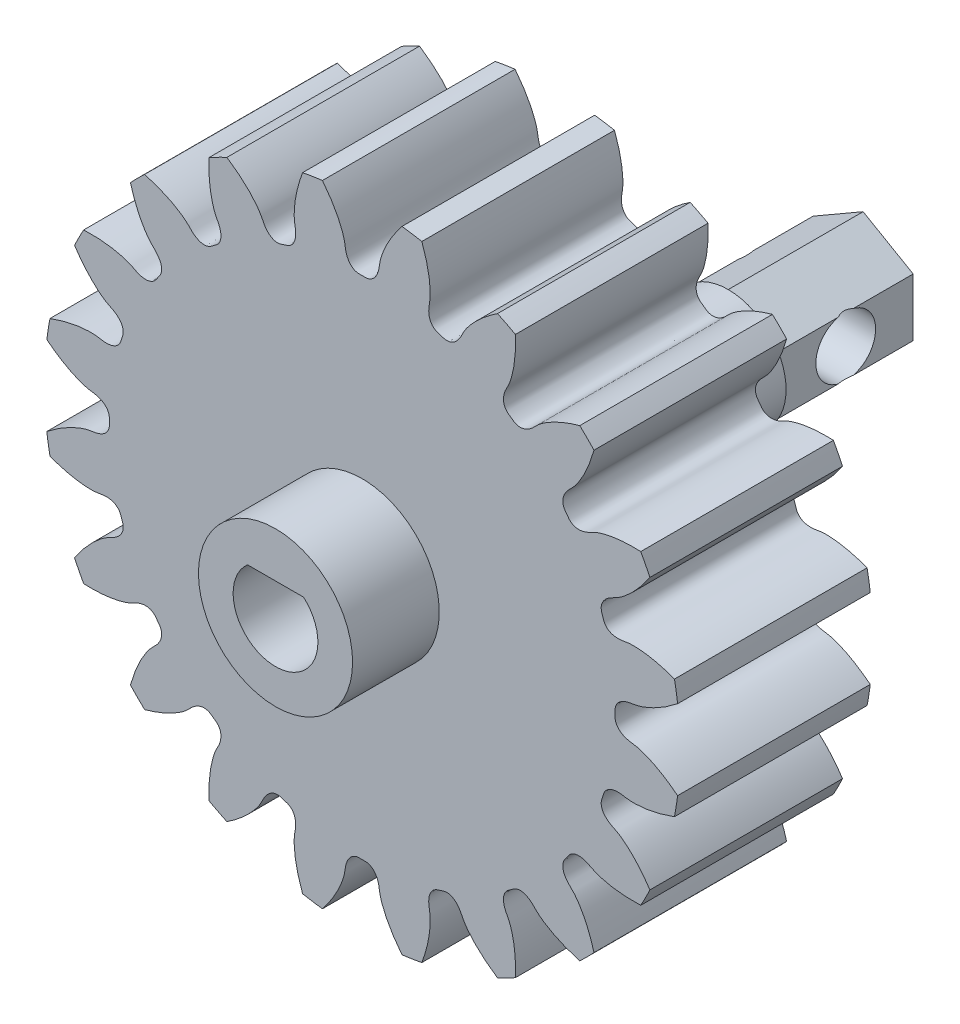
from build123d import *

# Parameters (mm, degrees)
SKETCHREVOLVESPURASSEMBLY01PINION_W       = 10
SKETCHREVOLVESPURASSEMBLY01PINION_H       = 16.499999752
TOOTHEXTRUDECUTSPURASSEMBLY01PINION_DEPTH = 5
PATTERNSPURASSEMBLY01PINION_COUNT         = 20
SKETCH2_R                                 = 3
BOSS_EXTRUDE1_DEPTH                       = 9
BOSS_EXTRUDE2_DEPTH                       = 7
CUT_EXTRUDE3_REACH                        = 34.692
SKETCH4_R                                 = 1.55
SKETCH5_R                                 = 4
BOSS_EXTRUDE3_DEPTH                       = 4.5
CUT_EXTRUDE4_DEPTH                        = 8


with BuildPart() as part:
    # SketchRevolveSpurAssembly01Pinion → SpurAssembly01Pinion (revolve)
    with BuildSketch(Plane(origin=(0, 0, 0), x_dir=(0, 0, -1), z_dir=(1, 0, 0)), mode=Mode.PRIVATE) as spurassembly01pinion_sk:
        with Locations((0, 8.249999876)):
            Rectangle(SKETCHREVOLVESPURASSEMBLY01PINION_W, SKETCHREVOLVESPURASSEMBLY01PINION_H)
    revolve(spurassembly01pinion_sk.sketch.rotate(Axis((0, 0, 0), (0, 0, -1)), 90), axis=Axis((0, 0, 0), (0, 0, -1)))

    # SketchToothSpurAssembly01Pinion → ToothExtrudeCutSpurAssembly01Pinion (cut, symmetric)
    with BuildSketch(Plane.XY):
        with BuildLine():
            ThreePointArc((16.438815928, 2.120364973), (16.574999751, 0), (16.438815928, -2.120364973))
            add(Edge.make_bspline(
                [(16.438815928, -2.120364973), (16.306213447, -2.012632117), (16.10792267, -1.860929635), (15.841705586, -1.676668952), (15.654853966, -1.55570694), (15.475899367, -1.447553762), (15.305444286, -1.351598726), (15.144060802, -1.267206194), (14.992289617, -1.193717223), (14.850639167, -1.130450865), (14.719584807, -1.0767054), (14.599567969, -1.031760257), (14.490995634, -0.99487577), (14.394239041, -0.965299916), (14.309634999, -0.942253529), (14.237479548, -0.924980687), (14.178044201, -0.912608864), (14.049223501, -0.890261122), (13.912281496, -0.878231728), (13.769652297, -0.842658369), (13.695599357, -0.820644128), (13.624377747, -0.794966749), (13.555692175, -0.765356143), (13.489258635, -0.731124882), (13.424830796, -0.691333031), (13.362331646, -0.644635632), (13.30209452, -0.589245233), (13.24524803, -0.523019137), (13.194309632, -0.443877425), (13.153279262, -0.350864326), (13.130262908, -0.253354669), (13.120821868, -0.134969136), (13.12767395, 0), (13.120821868, 0.134969136), (13.130262908, 0.253354669), (13.153279262, 0.350864326), (13.194309632, 0.443877425), (13.24524803, 0.523019137), (13.30209452, 0.589245233), (13.362331646, 0.644635632), (13.424830796, 0.691333031), (13.489258635, 0.731124882), (13.555692175, 0.765356143), (13.624377747, 0.794966749), (13.695599357, 0.820644128), (13.769652297, 0.842658369), (13.912281496, 0.878231728), (14.049223501, 0.890261122), (14.178044201, 0.912608864), (14.237479548, 0.924980687), (14.309634999, 0.942253529), (14.394239041, 0.965299916), (14.490995634, 0.99487577), (14.599567969, 1.031760257), (14.719584807, 1.0767054), (14.850639167, 1.130450865), (14.992289617, 1.193717223), (15.144060802, 1.267206194), (15.305444286, 1.351598726), (15.475899367, 1.447553762), (15.654853966, 1.55570694), (15.841705586, 1.676668952), (16.10792267, 1.860929635), (16.306213447, 2.012632117), (16.438815928, 2.120364973)],
                knots=[0, 0, 0, 0, 0.061422842, 0.089709677, 0.116380121, 0.141434175, 0.164871838, 0.186693111, 0.206897994, 0.225486485, 0.242458587, 0.257814298, 0.271553618, 0.283676548, 0.294183087, 0.303073236, 0.310346995, 0.316004363, 0.350076802, 0.359567688, 0.36880314, 0.37784437, 0.386769007, 0.395675631, 0.404688756, 0.413962948, 0.423682731, 0.434051196, 0.445255861, 0.457401439, 0.47041984, 0.481066796, 0.5, 0.518933204, 0.52958016, 0.542598561, 0.554744139, 0.565948804, 0.576317269, 0.586037052, 0.595311244, 0.604324369, 0.613230993, 0.62215563, 0.63119686, 0.640432312, 0.649923198, 0.683995637, 0.689653005, 0.696926764, 0.705816913, 0.716323452, 0.728446382, 0.742185702, 0.757541413, 0.774513515, 0.793102006, 0.813306889, 0.835128162, 0.858565825, 0.883619879, 0.910290323, 0.938577158, 1, 1, 1, 1], degree=3))
        make_face()
    toothextrudecutspurassembly01pinion = extrude(amount=TOOTHEXTRUDECUTSPURASSEMBLY01PINION_DEPTH, both=True, mode=Mode.SUBTRACT)

    # PatternSpurAssembly01Pinion: ToothExtrudeCutSpurAssembly01Pinion ×20 about axis
    patternspurassembly01pinion_axis = Axis((0, 0, 55), (0, 0, -1))
    for i in range(1, PATTERNSPURASSEMBLY01PINION_COUNT):
        add(toothextrudecutspurassembly01pinion.rotate(patternspurassembly01pinion_axis, i * 360 / PATTERNSPURASSEMBLY01PINION_COUNT), mode=Mode.SUBTRACT)

    # Sketch2 → Boss-Extrude1 (add)
    with BuildSketch(Plane(origin=(0, 0, -5), x_dir=(-1, 0, 0), z_dir=(0, 0, -1))):
        with Locations(Location((0, 0, 0), (0, 0, 180))):
            Circle(SKETCH2_R)
    extrude(amount=BOSS_EXTRUDE1_DEPTH)

    # Sketch3 → Boss-Extrude2 (add)
    with BuildSketch(Plane(origin=(0, 0, -14), x_dir=(-1, 0, 0), z_dir=(0, 0, -1))):
        Polygon((0, 3), (-2.598076211, 1.5), (-2.598076211, -1.5), (0, -3), (2.598076211, -1.5), (2.598076211, 1.5), align=None)
    extrude(amount=BOSS_EXTRUDE2_DEPTH)

    # Cut-Extrude3: up to this face of the body (flat: up to its plane)
    cut_extrude3_end = Plane(part.part.faces().sort_by_distance((-2.598076211, 0, -17.5))[0])
    # Sketch4 → Cut-Extrude3 (cut, up to the picked face)
    with BuildSketch(Plane(origin=(2.598076211, 0, 0), x_dir=(0, 0, -1), z_dir=(1, 0, 0)), mode=Mode.PRIVATE) as cut_extrude3_sk1:
        with Locations(Location((17.5, 0, 0), (0, 0, 104.592550602))):
            Circle(SKETCH4_R)
    cut_extrude3_tool1 = split(extrude(cut_extrude3_sk1.sketch, amount=-CUT_EXTRUDE3_REACH, mode=Mode.PRIVATE), bisect_by=cut_extrude3_end, keep=Keep.BOTH, mode=Mode.PRIVATE)
    add(cut_extrude3_tool1.solids().sort_by(Axis((2.598076, 0, -17.5), (-1, 0, 0)))[0], mode=Mode.SUBTRACT)

    # Sketch5 → Boss-Extrude3 (add)
    with BuildSketch(Plane.XY.offset(5)):
        with Locations(Location((0, 0, 0), (0, 0, 180))):
            Circle(SKETCH5_R)
    extrude(amount=BOSS_EXTRUDE3_DEPTH)

    # Sketch6 → Cut-Extrude4 (cut)
    with BuildSketch(Plane.XY.offset(9.5)):
        with BuildLine():
            Line((-1.455163221, 1.65), (1.455163221, 1.65))
            ThreePointArc((1.455163221, 1.65), (0, -2.2), (-1.455163221, 1.65))
        make_face()
    extrude(amount=-CUT_EXTRUDE4_DEPTH, mode=Mode.SUBTRACT)


solid = part.part
